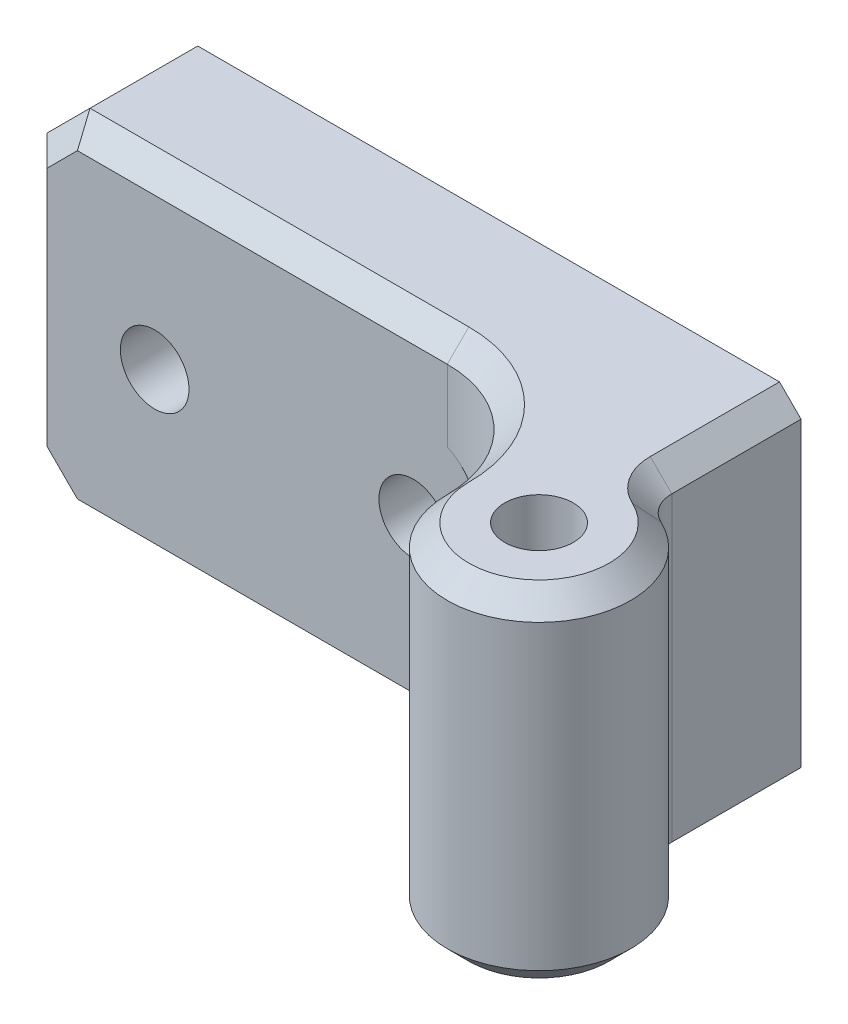
from build123d import *

# Parameters (mm, degrees)
SKETCH1_W                  = 47.625
SKETCH1_H                  = 25.4
BOSS_EXTRUDE1_DEPTH        = 9.525
SKETCH2_R                  = 6.757528855
BOSS_EXTRUDE2_DEPTH        = 25.4
BOSS_EXTRUDE3_DEPTH        = 25.4
F_8_0_199_DIAMETER_HOLE1_D = 5.0546
CHAMFER1_SIZE              = 3.175
CHAMFER2_SIZE              = 1.5875
F_8_0_199_DIAMETER_HOLE2_D = 5.0546
CUT_EXTRUDE1_REACH         = 714.11
SKETCH11_R                 = 6.35


with BuildPart() as part:
    # Sketch1 → Boss-Extrude1 (new body)
    with BuildSketch(Plane.XY):
        with Locations((-14.2875, 698.230229864)):
            Rectangle(SKETCH1_W, SKETCH1_H)
    extrude(amount=BOSS_EXTRUDE1_DEPTH)



with BuildPart() as body_2:
    # Sketch2 → Boss-Extrude2 (new body)
    with BuildSketch(Plane(origin=(0, 710.930229864, 0), x_dir=(-1, 0, 0), z_dir=(0, -1, 0))):
        with Locations(Location((-8.061541228, -17.843768092, 0), (0, 0, 270))):
            Circle(SKETCH2_R)
    extrude(amount=BOSS_EXTRUDE2_DEPTH)


with BuildPart() as part_1:
    add(part.part)

    add(body_2.part)  # Boss-Extrude3 merges body 2
    # Sketch3 → Boss-Extrude3 (add)
    with BuildSketch(Plane.XZ.offset(-685.530229864)):
        with BuildLine():
            Line((9.525, 9.525), (-7.01475572, 9.525))
            ThreePointArc((-7.01475572, 9.525), (-1.132498391, 11.961510763), (1.304012372, 17.843768092))
            ThreePointArc((1.304012372, 17.843768092), (4.433439084, 12.142797029), (10.923230214, 11.722090841))
            ThreePointArc((10.923230214, 11.722090841), (9.904202194, 10.827138231), (9.525, 9.525))
        make_face()
    extrude(amount=-BOSS_EXTRUDE3_DEPTH)

    # #8 (0.199) Diameter Hole1 (through all)
    with Locations(Plane(origin=(0, 710.930229864, 0), x_dir=(1, 0, 0), z_dir=(0, 1, 0))):
        with Locations((8.061541228, -17.843768092)):
            f_8_0_199_diameter_hole1 = Hole(F_8_0_199_DIAMETER_HOLE1_D / 2)

    # Chamfer1
    chamfer1_edges = [part_1.edges().sort_by_distance(p)[0] for p in [
        (-38.1, 710.930229864, 4.7625),
        (-38.1, 685.530229864, 4.7625),
    ]]
    chamfer(chamfer1_edges, length=CHAMFER1_SIZE)

    # Chamfer2
    chamfer2_edges = [part_1.edges().sort_by_distance(p)[0] for p in [
        (-20.96987786, 710.930229864, 9.525),
        (9.904202194, 685.530229864, 10.827138231),
        (-1.132498391, 685.530229864, 11.961510763),
        (9.904202194, 710.930229864, 10.827138231),
        (-1.132498391, 710.930229864, 11.961510763),
        (11.689643371, 685.530229864, 23.544739156),
        (11.689643371, 710.930229864, 23.544739156),
        (-20.96987786, 685.530229864, 9.525),
        (-38.1, 698.230229864, 9.525),
        (-36.5125, 709.342729864, 9.525),
        (-36.5125, 687.117729864, 9.525),
        (9.525, 710.930229864, 4.7625),
        (9.525, 685.530229864, 4.7625),
    ]]
    chamfer(chamfer2_edges, length=CHAMFER2_SIZE)

    # Mirror2: #8 (0.199) Diameter Hole1 across plane
    add(f_8_0_199_diameter_hole1.mirror(Plane.ZX.offset(698.230229864)), mode=Mode.SUBTRACT)

    # #8 (0.199) Diameter Hole2 (through all)
    with Locations(Plane(origin=(0, 0, 0), x_dir=(-1, 0, 0), z_dir=(0, 0, -1))):
        with Locations((9.525, 698.230229864), (28.575, 698.230229864)):
            Hole(F_8_0_199_DIAMETER_HOLE2_D / 2)

    # Sketch11 → Cut-Extrude1 (cut, up to next)
    with BuildSketch(Plane.XY.offset(9.525), mode=Mode.PRIVATE) as cut_extrude1_sk1:
        with Locations((-9.525, 698.230229864)):
            Circle(SKETCH11_R)
    cut_extrude1_tool1 = extrude(cut_extrude1_sk1.sketch, amount=CUT_EXTRUDE1_REACH, mode=Mode.PRIVATE) & part_1.part
    add(cut_extrude1_tool1.solids().sort_by_distance((-9.525, 698.23023, 9.525))[0], mode=Mode.SUBTRACT)


solid = part_1.part
